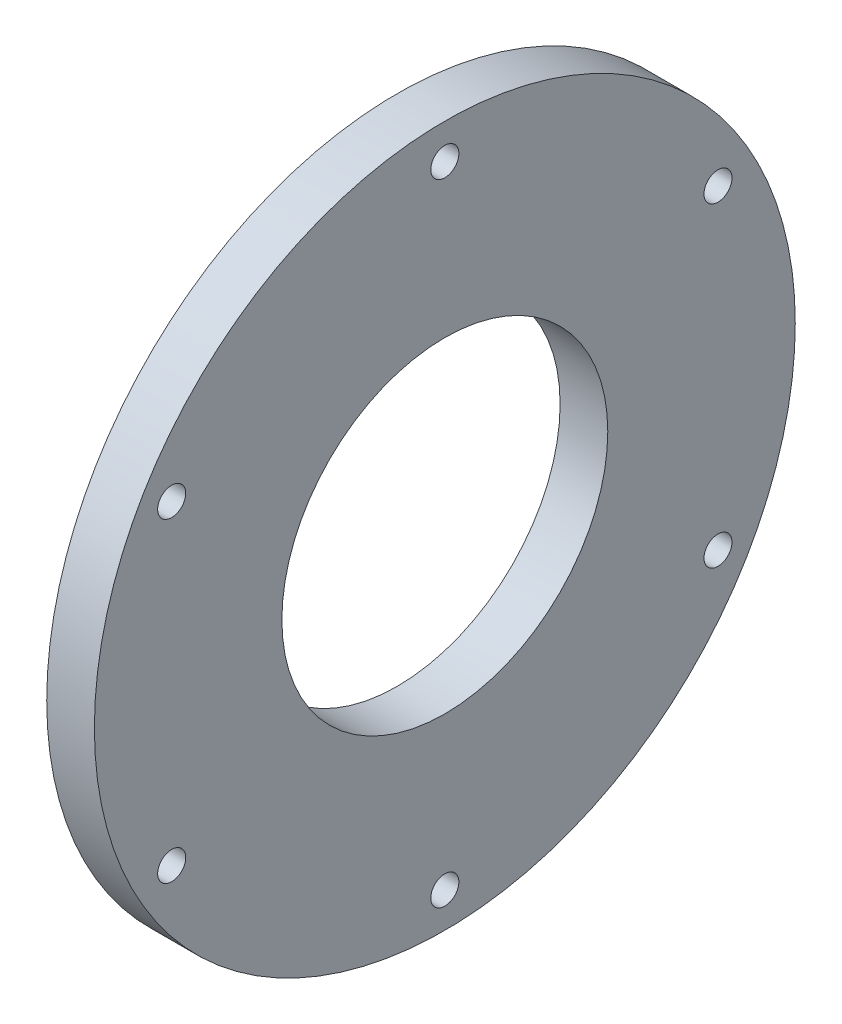
from build123d import *

# Parameters (mm, degrees)
SKETCH1_R           = 100
SKETCH1_R_2         = 46.5
BOSS_EXTRUDE1_DEPTH = 13.6
HOLE1_D             = 8
HOLE1_DEPTH         = 15
HOLE1_CBORE_D       = 15
HOLE1_CBORE_DEPTH   = 2
HOLE1_TIP           = 2.403442476


with BuildPart() as part:
    # Sketch1 → Boss-Extrude1 (new body)
    with BuildSketch(Plane(origin=(0, 0, 0), x_dir=(0, 0, -1), z_dir=(1, 0, 0))):
        Circle(SKETCH1_R)
        Circle(SKETCH1_R_2, mode=Mode.SUBTRACT)
    extrude(amount=BOSS_EXTRUDE1_DEPTH)

    # Hole1
    with Locations(Plane.ZY):
        with Locations((-77.942286341, 45), (0, 90), (77.942286341, 45), (77.942286341, -45), (0, -90), (-77.942286341, -45)):
            CounterBoreHole(HOLE1_D / 2, HOLE1_CBORE_D / 2, HOLE1_CBORE_DEPTH, depth=HOLE1_DEPTH)
            with Locations((0, 0, -(HOLE1_DEPTH + HOLE1_TIP / 2))):  # 118° drill point
                Cone(0, HOLE1_D / 2, HOLE1_TIP, mode=Mode.SUBTRACT)


solid = part.part
